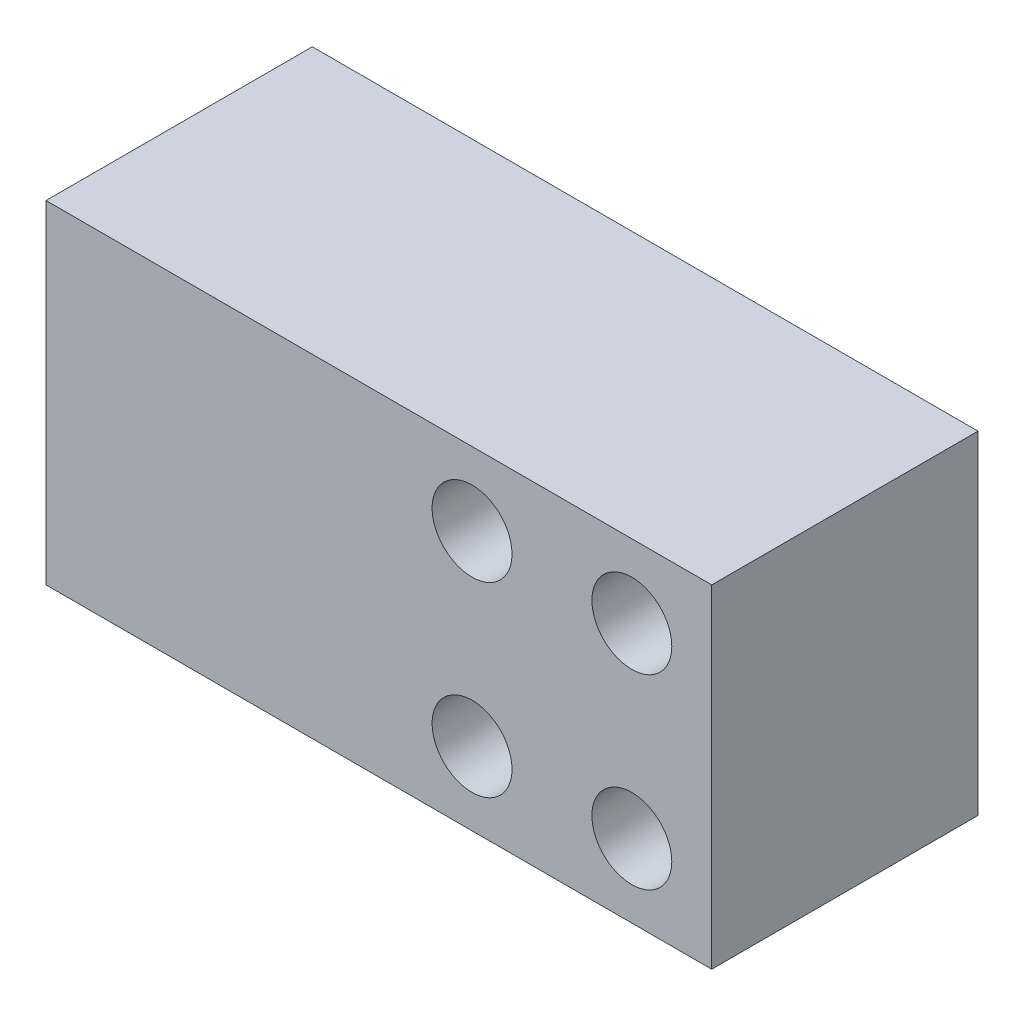
from build123d import *

# Parameters (mm, degrees)
SKETCH_1_W          = 50
SKETCH_1_H          = 25
EXTRUDE_1_DEPTH     = 20
SKETCH_2_R          = 3
CUT_EXTRUDE_1_DEPTH = 45


with BuildPart() as part:
    # 草图1 → 凸台-拉伸1 (new body)
    with BuildSketch(Plane.XY):
        with Locations((25, -12.5)):
            Rectangle(SKETCH_1_W, SKETCH_1_H)
    extrude(amount=EXTRUDE_1_DEPTH)

    # 草图2 → 切除-拉伸1 (cut)
    with BuildSketch(Plane.XY.offset(20)):
        with Locations((44, -5.5)):
            Circle(SKETCH_2_R)
        with Locations((32, -5.5)):
            Circle(SKETCH_2_R)
        with Locations((32, -19.5)):
            Circle(SKETCH_2_R)
        with Locations((44, -19.5)):
            Circle(SKETCH_2_R)
    extrude(amount=-CUT_EXTRUDE_1_DEPTH, mode=Mode.SUBTRACT)


solid = part.part
